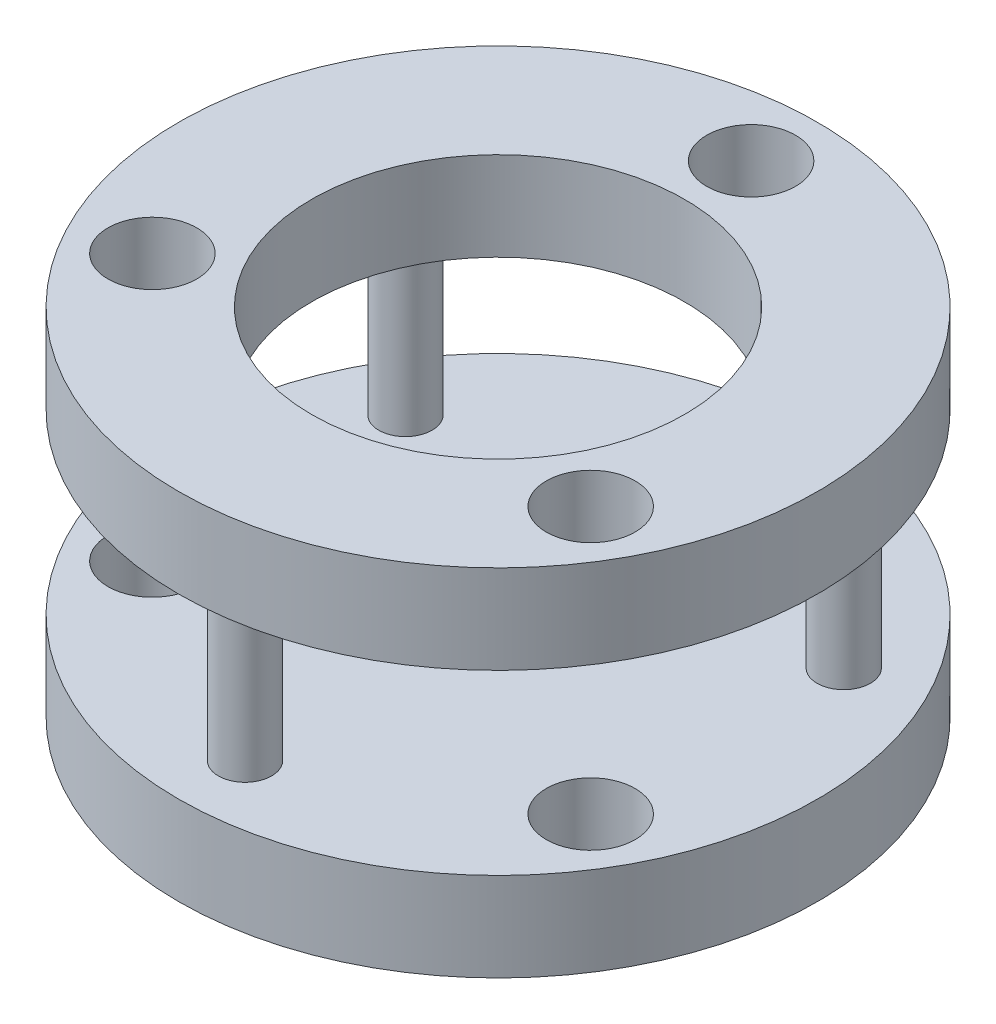
from build123d import *

# Parameters (mm, degrees)
SKETCH1_R           = 36
SKETCH1_R_2         = 5
SKETCH1_R_3         = 3
SKETCH1_R_4         = 21
BOSS_EXTRUDE1_DEPTH = 10
SKETCH1_3_R         = 3
BOSS_EXTRUDE2_DEPTH = 40
LPATTERN3_COUNT     = 2
LPATTERN3_PITCH     = 30
SKETCH2_R           = 21
BOSS_EXTRUDE3_DEPTH = 10
SKETCH4_R           = 5
BOSS_EXTRUDE4_DEPTH = 20
FILLET1_R           = 10


with BuildPart() as part:
    # Sketch1 → Boss-Extrude1 (new body)
    with BuildSketch(Plane(origin=(0, 0, 0), x_dir=(1, 0, 0), z_dir=(0, 1, 0))):
        Circle(SKETCH1_R)
        with Locations((0, 28.5)):
            Circle(SKETCH1_R_2, mode=Mode.SUBTRACT)
        with Locations((24.681724008, 14.25)):
            Circle(SKETCH1_R_3, mode=Mode.SUBTRACT)
        with Locations((24.681724008, -14.25)):
            Circle(SKETCH1_R_2, mode=Mode.SUBTRACT)
        with Locations((0, -28.5)):
            Circle(SKETCH1_R_3, mode=Mode.SUBTRACT)
        with Locations((-24.681724008, -14.25)):
            Circle(SKETCH1_R_2, mode=Mode.SUBTRACT)
        with Locations((-24.681724008, 14.25)):
            Circle(SKETCH1_R_3, mode=Mode.SUBTRACT)
        Circle(SKETCH1_R_4, mode=Mode.SUBTRACT)
    boss_extrude1 = extrude(amount=BOSS_EXTRUDE1_DEPTH)

    # Sketch1<3> → Boss-Extrude2 (add)
    with BuildSketch(Plane(origin=(0, 0, 0), x_dir=(1, 0, 0), z_dir=(0, 1, 0))):
        with Locations((0, -28.5)):
            Circle(SKETCH1_3_R)
        with Locations((-24.681724008, 14.25)):
            Circle(SKETCH1_3_R)
        with Locations((24.681724008, 14.25)):
            Circle(SKETCH1_3_R)
    extrude(amount=BOSS_EXTRUDE2_DEPTH)

    # LPattern3: Boss-Extrude1 ×2
    with Locations(*[(0, i * LPATTERN3_PITCH, 0) for i in range(1, LPATTERN3_COUNT)]):
        add(boss_extrude1)

    # Sketch2 → Boss-Extrude3 (add)
    with BuildSketch(Plane.XZ):
        Circle(SKETCH2_R)
    extrude(amount=-BOSS_EXTRUDE3_DEPTH)

    # Sketch4 → Boss-Extrude4 (add)
    with BuildSketch(Plane.XZ):
        Circle(SKETCH4_R)
    extrude(amount=BOSS_EXTRUDE4_DEPTH)

    # Fillet1
    fillet1_edges = [part.edges().sort_by_distance(p)[0] for p in [
        (-5, 0, 0),
    ]]
    fillet(fillet1_edges, radius=FILLET1_R)


solid = part.part
